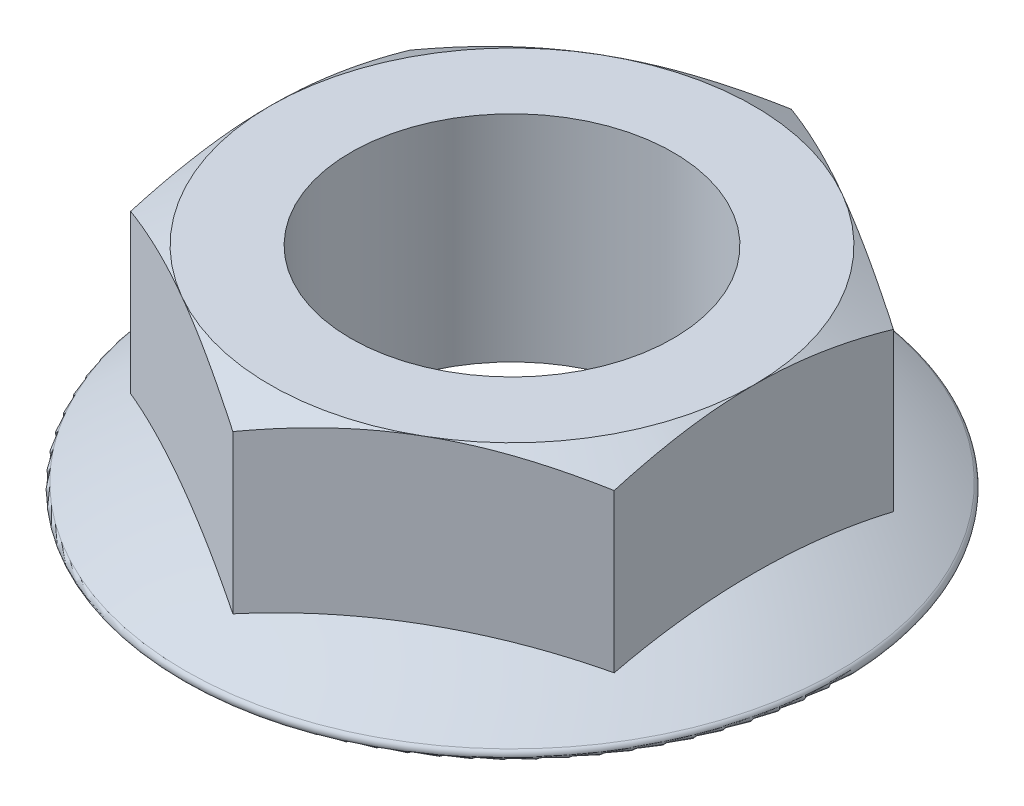
from build123d import *

# Parameters (mm, degrees)
BOSS_EXTRUDE1_DEPTH   = 20
FILLET1_R             = 0.5
F_1_0MM_DOWEL_HOLE1_D = 30


with BuildPart() as part:
    # Sketch1 → Boss-Extrude1 (new body)
    with BuildSketch(Plane(origin=(0, 0, 0), x_dir=(1, 0, 0), z_dir=(0, 1, 0))):
        Polygon((0, -25.980762114), (22.5, -12.990381057), (22.5, 12.990381057), (0, 25.980762114), (-22.5, 12.990381057), (-22.5, -12.990381057), align=None)
    extrude(amount=BOSS_EXTRUDE1_DEPTH)

    # Sketch2 → Revolve1 (revolve)
    with BuildSketch(Plane(origin=(0, 0, 0), x_dir=(0, 0, -1), z_dir=(1, 0, 0)), mode=Mode.PRIVATE) as revolve1_sk:
        with BuildLine():
            Line((0, 9.214199819), (0, 0))
            Line((0, 0), (31.95, 0))
            ThreePointArc((31.95, 0), (16.626063713, 6.864646525), (0, 9.214199819))
        make_face()
    revolve(revolve1_sk.sketch.rotate(Axis((0, 0, 0), (0, -1, 0)), 180), axis=Axis((0, 0, 0), (0, -1, 0)))

    # Fillet1
    fillet1_edges = [part.edges().sort_by_distance(p)[0] for p in [
        (0, 0, -31.95),
    ]]
    fillet(fillet1_edges, radius=FILLET1_R)

    # Ø1.0mm Dowel Hole1 (through all)
    with Locations(Plane(origin=(0, 20, 0), x_dir=(1, 0, 0), z_dir=(0, 1, 0))):
        with Locations((0, 0)):
            Hole(F_1_0MM_DOWEL_HOLE1_D / 2)

    # Sketch6 → Cut-Revolve2 (revolve, cut)
    with BuildSketch(Plane.XY, mode=Mode.PRIVATE) as cut_revolve2_sk:
        Polygon((22.5, 20), (28.5, 20), (28.5, 16.535898385), align=None)
    revolve(cut_revolve2_sk.sketch.rotate(Axis((0, 0, 0), (0, -1, 0)), 90), axis=Axis((0, 0, 0), (0, -1, 0)), mode=Mode.SUBTRACT)


solid = part.part
